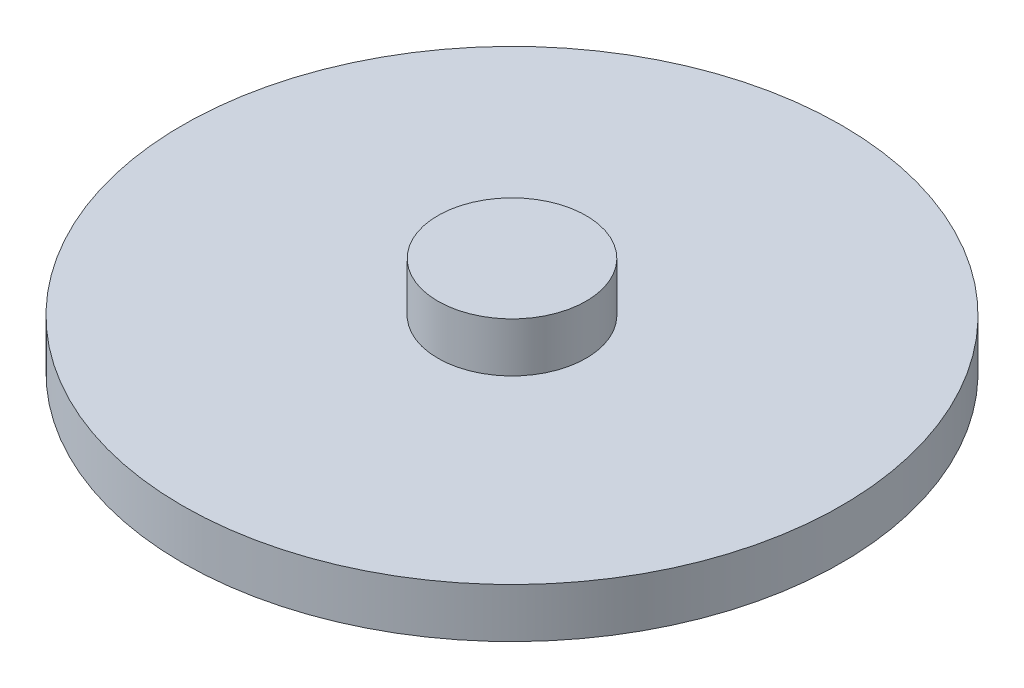
from build123d import *

# Parameters (mm, degrees)
SKETCH1_R           = 20
BOSS_EXTRUDE1_DEPTH = 3
SKETCH2_R           = 4.5
BOSS_EXTRUDE2_DEPTH = 3


with BuildPart() as part:
    # Sketch1 → Boss-Extrude1 (new body)
    with BuildSketch(Plane(origin=(0, 0, 0), x_dir=(1, 0, 0), z_dir=(0, 1, 0))):
        with Locations(Location((-10.269097216, 11.384027771, 0), (0, 0, 270))):
            Circle(SKETCH1_R)
    extrude(amount=BOSS_EXTRUDE1_DEPTH)

    # Sketch2 → Boss-Extrude2 (add)
    with BuildSketch(Plane(origin=(0, 3, 0), x_dir=(1, 0, 0), z_dir=(0, 1, 0))):
        with Locations(Location((-10.269097216, 11.384027771, 0), (0, 0, 270))):
            Circle(SKETCH2_R)
    extrude(amount=BOSS_EXTRUDE2_DEPTH)


solid = part.part
